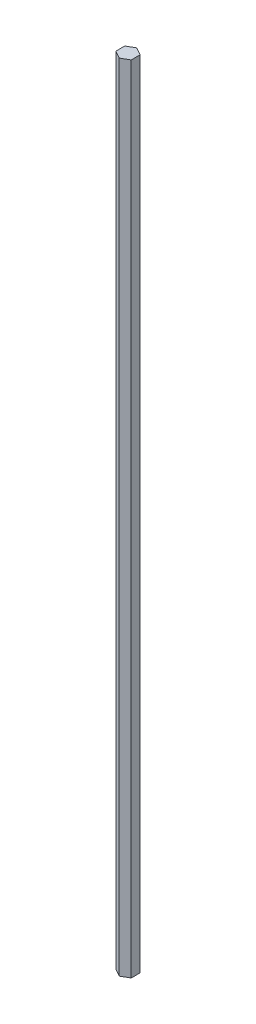
from build123d import *

# Parameters (mm, degrees)
BOSS_EXTRUDE1_DEPTH = 660.4


with BuildPart() as part:
    # Sketch1 → Boss-Extrude1 (new body)
    with BuildSketch(Plane(origin=(0, 0, 0), x_dir=(1, 0, 0), z_dir=(0, 1, 0))):
        Polygon((0, 7.332348419), (-6.35, 3.666174209), (-6.35, -3.666174209), (0, -7.332348419), (6.35, -3.666174209), (6.35, 3.666174209), align=None)
    extrude(amount=BOSS_EXTRUDE1_DEPTH)


solid = part.part
